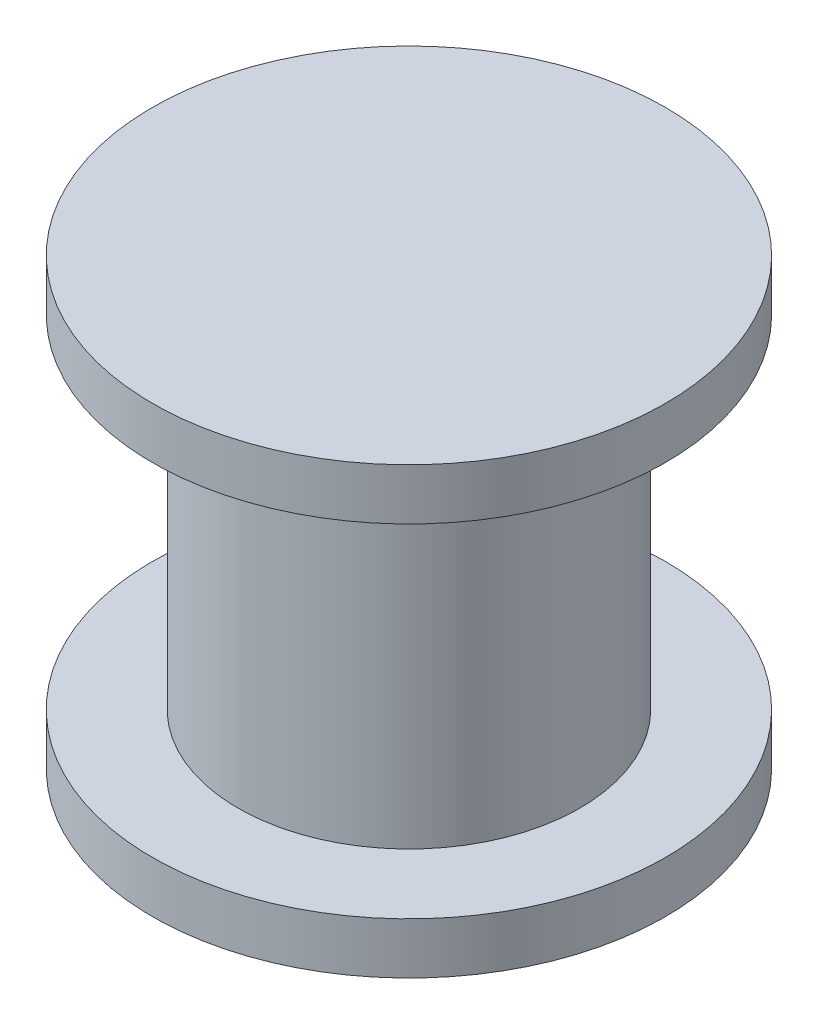
from build123d import *

# Parameters (mm, degrees)
SKETCH_1_W   = 15
SKETCH_1_H   = 3
SKETCH_1_W_2 = 10
SKETCH_1_H_2 = 20


with BuildPart() as part:
    # 草圖1 → 旋轉1 (revolve)
    with BuildSketch(Plane.XY, mode=Mode.PRIVATE) as revolve_1_sk:
        with Locations((-7.5, 1.5)):
            Rectangle(SKETCH_1_W, SKETCH_1_H)
        with Locations((-5, 13)):
            Rectangle(SKETCH_1_W_2, SKETCH_1_H_2)
        Polygon((-10, 23), (0, 23), (0, 26), (-15, 26), (-15, 23), align=None)
    revolve(revolve_1_sk.sketch.rotate(Axis((0, 0, 0), (0, 1, 0)), 270), axis=Axis((0, 0, 0), (0, 1, 0)))


solid = part.part
